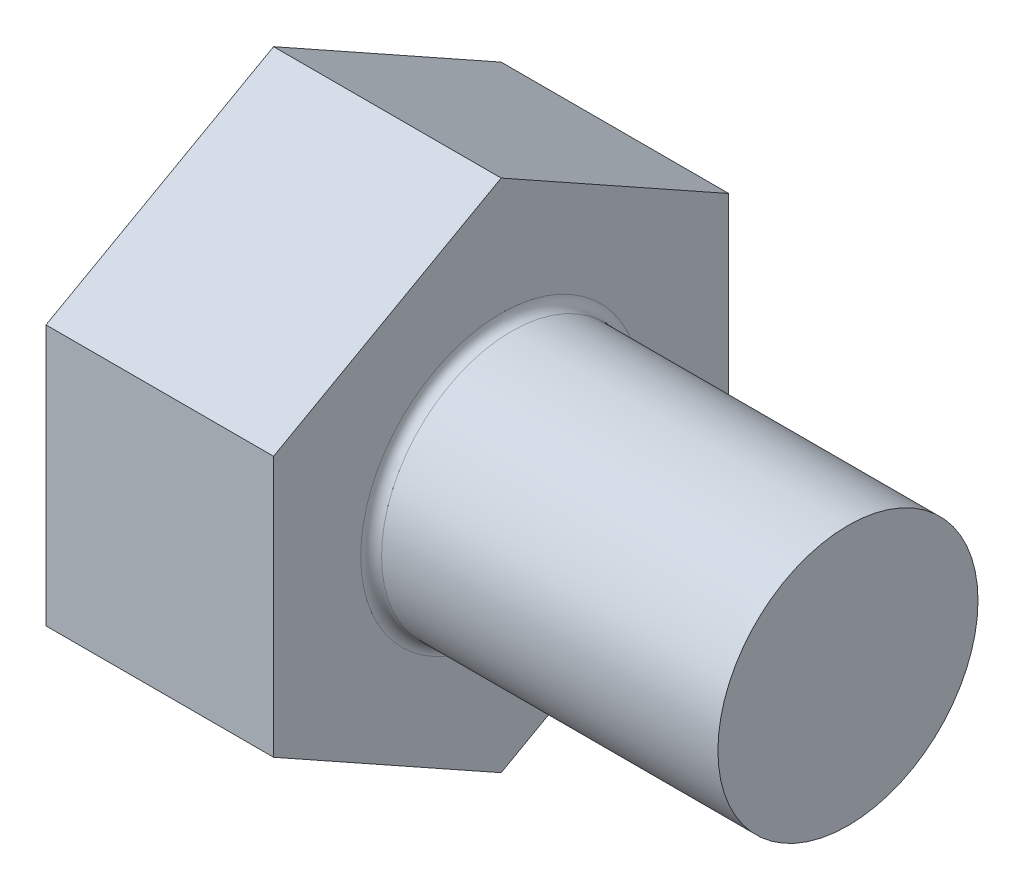
from build123d import *

# Parameters (mm, degrees)
SKETCH1_W           = 8.466666667
SKETCH1_H           = 3.175
BOSS_EXTRUDE1_DEPTH = 5.55625
FILLET1_R           = 0.254


with BuildPart() as part:
    # Sketch1 → Revolve1 (revolve)
    with BuildSketch(Plane.XY, mode=Mode.PRIVATE) as revolve1_sk:
        with Locations((4.233333334, 1.5875)):
            Rectangle(SKETCH1_W, SKETCH1_H)
    revolve(revolve1_sk.sketch.rotate(Axis((-10.583333333, 0, 0), (1, 0, 0)), 90), axis=Axis((-10.583333333, 0, 0), (1, 0, 0)))

    # Sketch2 → Boss-Extrude1 (add)
    with BuildSketch(Plane.ZY):
        Polygon((-5.55625, -3.182294901), (-5.55625, 3.182294901), (0, 6.2865), (5.55625, 3.182294901), (5.55625, -3.182294901), (0, -6.2865), align=None)
    extrude(amount=BOSS_EXTRUDE1_DEPTH)

    # Fillet1
    fillet1_edges = [part.edges().sort_by_distance(p)[0] for p in [
        (0, 0, -3.175),
    ]]
    fillet(fillet1_edges, radius=FILLET1_R)


solid = part.part
